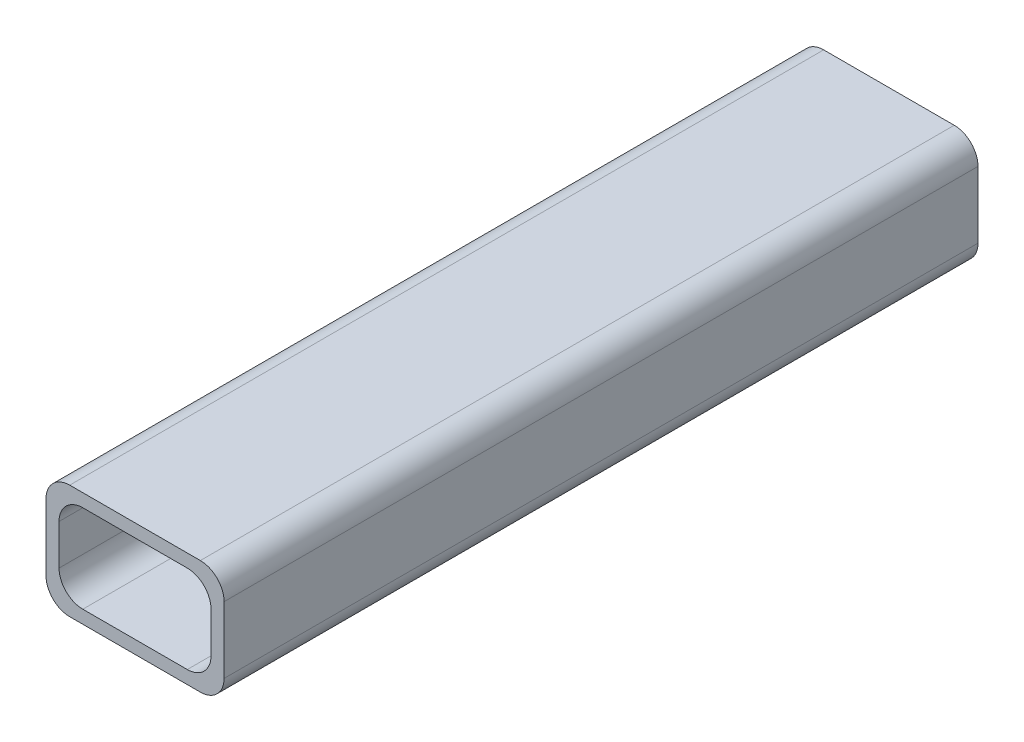
from build123d import *

# Parameters (mm, degrees)
BOSS_EXTRU_1_DEPTH      = 63.5
BOSS_EXTRU_1_DEPTH_BACK = 63.5
ESQUISSE1_W             = 30
ESQUISSE1_H             = 19.2
ESQUISSE1_W_2           = 25.6
ESQUISSE1_H_2           = 14.8
CONG_3_R                = 4


with BuildPart() as part:
    # Esquisse1 → Boss.-Extru.1 (new, two sides: drawn at the far end of the back side and taken through both)
    with BuildSketch(Plane.XY.offset(-BOSS_EXTRU_1_DEPTH_BACK)):
        Rectangle(ESQUISSE1_W, ESQUISSE1_H)
        Rectangle(ESQUISSE1_W_2, ESQUISSE1_H_2, mode=Mode.SUBTRACT)
    extrude(amount=BOSS_EXTRU_1_DEPTH + BOSS_EXTRU_1_DEPTH_BACK)

    # Congé3
    cong_3_edges = [part.edges().sort_by_distance(p)[0] for p in [
        (-12.8, -7.4, 0),
        (12.8, -7.4, 0),
        (12.8, 7.4, 0),
        (-12.8, 7.4, 0),
        (-15, -9.6, 0),
        (15, -9.6, 0),
        (15, 9.6, 0),
        (-15, 9.6, 0),
    ]]
    fillet(cong_3_edges, radius=CONG_3_R)


solid = part.part
